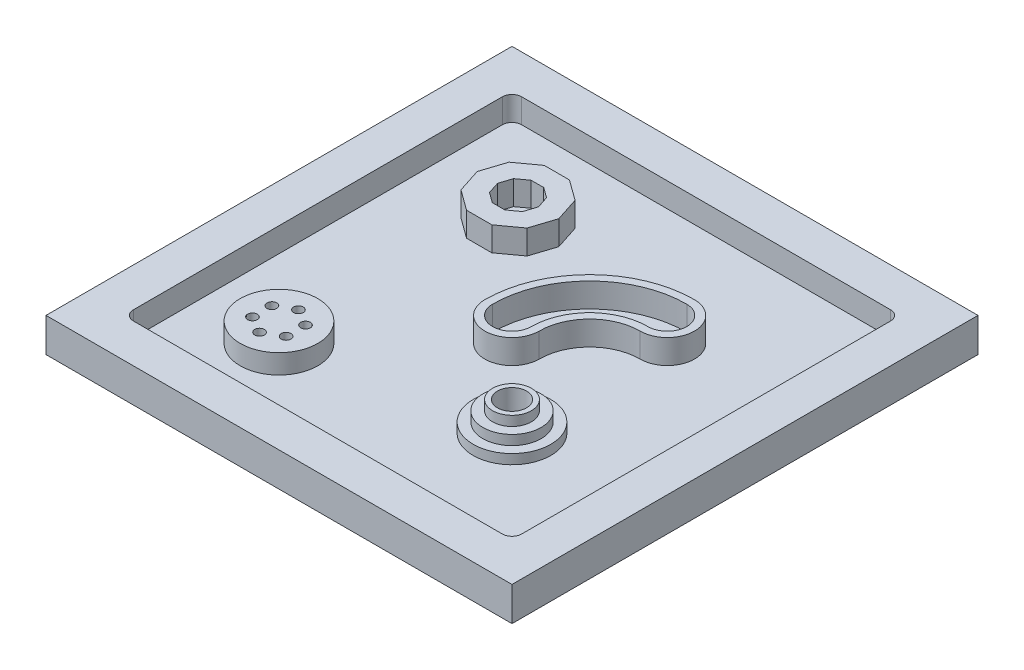
from build123d import *

# Parameters (mm, degrees)
SKETCH1_W           = 152.4
SKETCH1_H           = 152.4
BOSS_EXTRUDE1_DEPTH = 11.1125
CUT_EXTRUDE1_DEPTH  = 7.9375
SKETCH3_R           = 12.7
BOSS_EXTRUDE2_DEPTH = 6.35
SKETCH4_R           = 1.5875
CUT_EXTRUDE2_DEPTH  = 6.35
BOSS_EXTRUDE3_DEPTH = 7.9375
EXTRUDE_THIN6_DEPTH = 7.9375
SKETCH8_R           = 12.7
BOSS_EXTRUDE4_DEPTH = 3.175
SKETCH9_R           = 9.525
BOSS_EXTRUDE5_DEPTH = 3.175
SKETCH10_R          = 6.35
BOSS_EXTRUDE6_DEPTH = 3.175
SKETCH11_R          = 4.7625
CUT_EXTRUDE3_DEPTH  = 10.16


with BuildPart() as part:
    # Sketch1 → Boss-Extrude1 (new body)
    with BuildSketch(Plane(origin=(0, 0, 0), x_dir=(1, 0, 0), z_dir=(0, 1, 0))):
        with Locations((76.2, 76.2)):
            Rectangle(SKETCH1_W, SKETCH1_H)
    extrude(amount=BOSS_EXTRUDE1_DEPTH)

    # Sketch2 → Cut-Extrude1 (cut)
    with BuildSketch(Plane(origin=(0, 11.1125, 0), x_dir=(1, 0, 0), z_dir=(0, 1, 0))):
        with BuildLine():
            Line((136.525, 139.7), (15.875, 139.7))
            ThreePointArc((15.875, 139.7), (13.62993597, 138.77006403), (12.7, 136.525))
            Line((12.7, 136.525), (12.7, 15.875))
            ThreePointArc((12.7, 15.875), (13.62993597, 13.62993597), (15.875, 12.7))
            Line((15.875, 12.7), (136.525, 12.7))
            ThreePointArc((136.525, 12.7), (138.77006403, 13.62993597), (139.7, 15.875))
            Line((139.7, 15.875), (139.7, 136.525))
            ThreePointArc((139.7, 136.525), (138.77006403, 138.77006403), (136.525, 139.7))
        make_face()
    extrude(amount=-CUT_EXTRUDE1_DEPTH, mode=Mode.SUBTRACT)

    # Sketch3 → Boss-Extrude2 (add)
    with BuildSketch(Plane(origin=(0, 3.175, 0), x_dir=(1, 0, 0), z_dir=(0, 1, 0))):
        with Locations(Location((38.1, 38.1, 0), (0, 0, 270))):
            Circle(SKETCH3_R)
    extrude(amount=BOSS_EXTRUDE2_DEPTH)

    # Sketch4 → Cut-Extrude2 (cut)
    with BuildSketch(Plane(origin=(0, 9.525, 0), x_dir=(1, 0, 0), z_dir=(0, 1, 0))):
        with Locations(Location((38.1, 44.45, 0), (0, 0, 270))):
            Circle(SKETCH4_R)
        with Locations(Location((43.599261314, 41.275, 0), (0, 0, 270))):
            Circle(SKETCH4_R)
        with Locations(Location((43.599261314, 34.925, 0), (0, 0, 270))):
            Circle(SKETCH4_R)
        with Locations(Location((38.1, 31.75, 0), (0, 0, 270))):
            Circle(SKETCH4_R)
        with Locations(Location((32.600738686, 34.925, 0), (0, 0, 270))):
            Circle(SKETCH4_R)
        with Locations(Location((32.600738686, 41.275, 0), (0, 0, 270))):
            Circle(SKETCH4_R)
    extrude(amount=-CUT_EXTRUDE2_DEPTH, mode=Mode.SUBTRACT)

    # Sketch5 → Boss-Extrude3 (add)
    with BuildSketch(Plane(origin=(0, 3.175, 0), x_dir=(1, 0, 0), z_dir=(0, 1, 0))):
        Polygon((53.918108532, 103.404018082), (56.468413513, 111.25304974), (53.918108532, 119.102081397), (47.241323408, 123.95304974), (38.988363123, 123.95304974), (32.311578, 119.102081397), (29.761273018, 111.25304974), (32.311578, 103.404018082), (38.988363123, 98.55304974), (47.241323408, 98.55304974), align=None)
        Polygon((49.79162839, 111.25304974), (48.516475899, 115.177565568), (45.178083337, 117.60304974), (41.051603195, 117.60304974), (37.713210633, 115.177565568), (36.438058142, 111.25304974), (37.713210633, 107.328533911), (41.051603195, 104.90304974), (45.178083337, 104.90304974), (48.516475899, 107.328533911), align=None, mode=Mode.SUBTRACT)
    extrude(amount=BOSS_EXTRUDE3_DEPTH)

    # Sketch6 → Extrude-Thin6 (add)
    with BuildSketch(Plane(origin=(0, 3.175, 0), x_dir=(1, 0, 0), z_dir=(0, 1, 0))):
        with BuildLine():
            ThreePointArc((101.6, 92.71), (89.925667043, 87.874332957), (85.09, 76.2))
            ThreePointArc((85.09, 76.2), (76.2, 67.31), (67.31, 76.2))
            ThreePointArc((67.31, 76.2), (77.353308473, 100.446691527), (101.6, 110.49))
            ThreePointArc((101.6, 110.49), (110.49, 101.6), (101.6, 92.71))
        make_face()
        with BuildLine():
            ThreePointArc((101.6, 95.25), (88.129615818, 89.670384182), (82.55, 76.2))
            ThreePointArc((82.55, 76.2), (76.2, 69.85), (69.85, 76.2))
            ThreePointArc((69.85, 76.2), (79.149359697, 98.650640303), (101.6, 107.95))
            ThreePointArc((101.6, 107.95), (107.95, 101.6), (101.6, 95.25))
        make_face(mode=Mode.SUBTRACT)
    extrude(amount=EXTRUDE_THIN6_DEPTH)

    # Sketch8 → Boss-Extrude4 (add)
    with BuildSketch(Plane(origin=(0, 3.175, 0), x_dir=(1, 0, 0), z_dir=(0, 1, 0))):
        with Locations(Location((101.6, 50.8, 0), (0, 0, 270))):
            Circle(SKETCH8_R)
    extrude(amount=BOSS_EXTRUDE4_DEPTH)

    # Sketch9 → Boss-Extrude5 (add)
    with BuildSketch(Plane(origin=(0, 6.35, 0), x_dir=(1, 0, 0), z_dir=(0, 1, 0))):
        with Locations(Location((101.6, 50.8, 0), (0, 0, 270))):
            Circle(SKETCH9_R)
    extrude(amount=BOSS_EXTRUDE5_DEPTH)

    # Sketch10 → Boss-Extrude6 (add)
    with BuildSketch(Plane(origin=(0, 9.525, 0), x_dir=(1, 0, 0), z_dir=(0, 1, 0))):
        with Locations(Location((101.6, 50.8, 0), (0, 0, 270))):
            Circle(SKETCH10_R)
    extrude(amount=BOSS_EXTRUDE6_DEPTH)

    # Sketch11 → Cut-Extrude3 (cut)
    with BuildSketch(Plane(origin=(0, 12.7, 0), x_dir=(1, 0, 0), z_dir=(0, 1, 0))):
        with Locations(Location((101.6, 50.8, 0), (0, 0, 270))):
            Circle(SKETCH11_R)
    extrude(amount=-CUT_EXTRUDE3_DEPTH, mode=Mode.SUBTRACT)


solid = part.part
